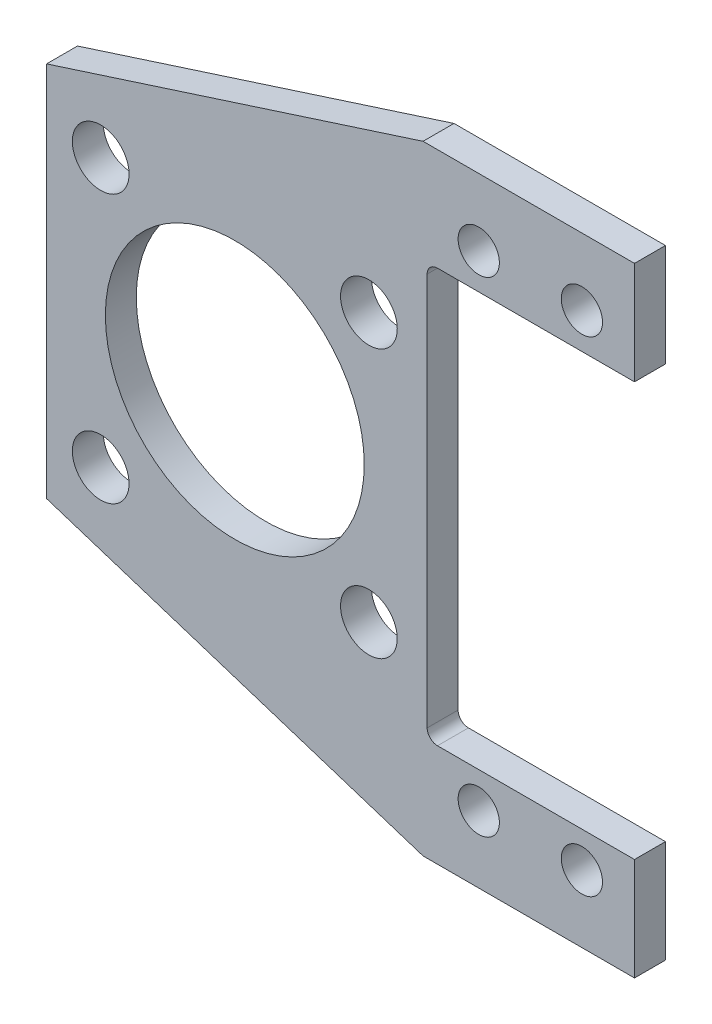
from build123d import *

# Parameters (mm, degrees)
SKETCH1_R           = 2.75
SKETCH1_R_2         = 12.55
SKETCH1_R_3         = 2
BOSS_EXTRUDE1_DEPTH = 3


with BuildPart() as part:
    # Sketch1 → Boss-Extrude1 (new body)
    with BuildSketch(Plane(origin=(0, 0, 0), x_dir=(0, 1, 0), z_dir=(0, 0, 1))):
        with BuildLine():
            Line((-18.25, 18.25), (18.25, 18.25))
            Line((18.25, 18.25), (30, -18.25))
            Line((30, -18.25), (30, -38.75))
            Line((30, -38.75), (20.05, -38.75))
            Line((20.05, -38.75), (20.05, -19.65))
            ThreePointArc((20.05, -19.65), (19.757106781, -18.942893219), (19.05, -18.65))
            Line((19.05, -18.65), (-19.05, -18.65))
            ThreePointArc((-19.05, -18.65), (-19.757106781, -18.942893219), (-20.05, -19.65))
            Line((-20.05, -19.65), (-20.05, -38.75))
            Line((-20.05, -38.75), (-30, -38.75))
            Line((-30, -38.75), (-30, -18.25))
            Line((-30, -18.25), (-18.25, 18.25))
        make_face()
        with Locations(Location((-13, 13, 0), (0, 0, 270))):
            Circle(SKETCH1_R, mode=Mode.SUBTRACT)
        with Locations(Location((0, 0, 0), (0, 0, 270))):
            Circle(SKETCH1_R_2, mode=Mode.SUBTRACT)
        with Locations(Location((13, 13, 0), (0, 0, 270))):
            Circle(SKETCH1_R, mode=Mode.SUBTRACT)
        with Locations(Location((13, -13, 0), (0, 0, 270))):
            Circle(SKETCH1_R, mode=Mode.SUBTRACT)
        with Locations(Location((-13, -13, 0), (0, 0, 270))):
            Circle(SKETCH1_R, mode=Mode.SUBTRACT)
        with Locations(Location((-23.5, -23.65, 0), (0, 0, 270))):
            Circle(SKETCH1_R_3, mode=Mode.SUBTRACT)
        with Locations(Location((23.5, -23.65, 0), (0, 0, 270))):
            Circle(SKETCH1_R_3, mode=Mode.SUBTRACT)
        with Locations(Location((23.5, -33.65, 0), (0, 0, 270))):
            Circle(SKETCH1_R_3, mode=Mode.SUBTRACT)
        with Locations(Location((-23.5, -33.65, 0), (0, 0, 270))):
            Circle(SKETCH1_R_3, mode=Mode.SUBTRACT)
    extrude(amount=BOSS_EXTRUDE1_DEPTH)


solid = part.part
